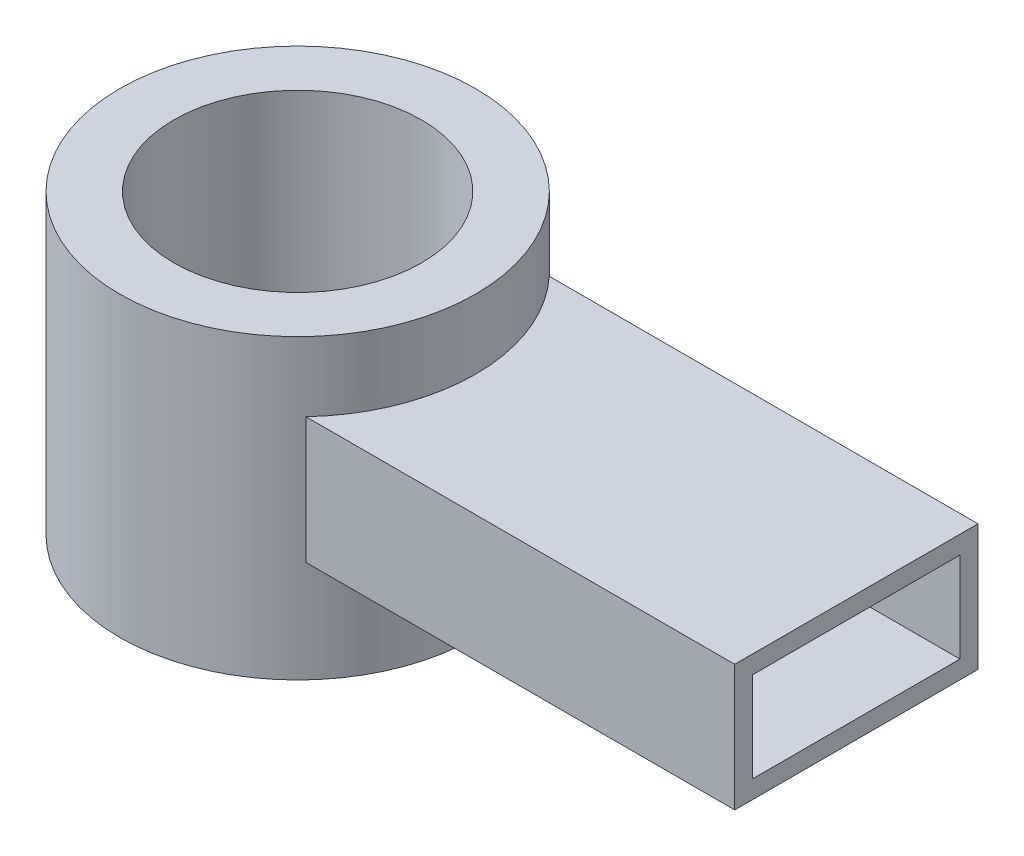
from build123d import *

# Parameters (mm, degrees)
SKETCH_356_R              = 19.75
SKETCH_356_R_2            = 13.75
EXTRUDE_6_27_5_3_10_DEPTH = 80
SKETCH_7_W                = 27
SKETCH_7_H                = 14
EXTRUDE_2_DEPTH           = 52
SKETCH_8_W                = 23
SKETCH_8_H                = 10
CUT_EXTRUDE_1_DEPTH       = 50
SKETCH_9_R                = 19.75
SKETCH_9_R_2              = 13.75
CUT_EXTRUDE_1_2_DEPTH     = 47


with BuildPart() as part:
    # Sketch 356 → 6分管 內直徑27.5厚度3長度10 (new body)
    with BuildSketch(Plane(origin=(0, 0, 0), x_dir=(1, 0, 0), z_dir=(0, 1, 0))):
        Circle(SKETCH_356_R)
        Circle(SKETCH_356_R_2, mode=Mode.SUBTRACT)
    extrude(amount=EXTRUDE_6_27_5_3_10_DEPTH)

    # 草圖7 → 填料-伸長2 (add)
    with BuildSketch(Plane(origin=(10, 0, 0), x_dir=(0, 0, -1), z_dir=(1, 0, 0))):
        with Locations((0, 65.299252319)):
            Rectangle(SKETCH_7_W, SKETCH_7_H)
    extrude(amount=EXTRUDE_2_DEPTH)

    # 草圖8 → Cut-Extrude 1 (cut)
    with BuildSketch(Plane(origin=(62, 0, 0), x_dir=(0, 0, -1), z_dir=(1, 0, 0))):
        with Locations((0, 65.299252319)):
            Rectangle(SKETCH_8_W, SKETCH_8_H)
    extrude(amount=-CUT_EXTRUDE_1_DEPTH, mode=Mode.SUBTRACT)

    # 草圖9 → Cut-Extrude 1 2 (cut)
    with BuildSketch(Plane.XZ):
        Circle(SKETCH_9_R)
        Circle(SKETCH_9_R_2, mode=Mode.SUBTRACT)
    extrude(amount=-CUT_EXTRUDE_1_2_DEPTH, mode=Mode.SUBTRACT)


solid = part.part
